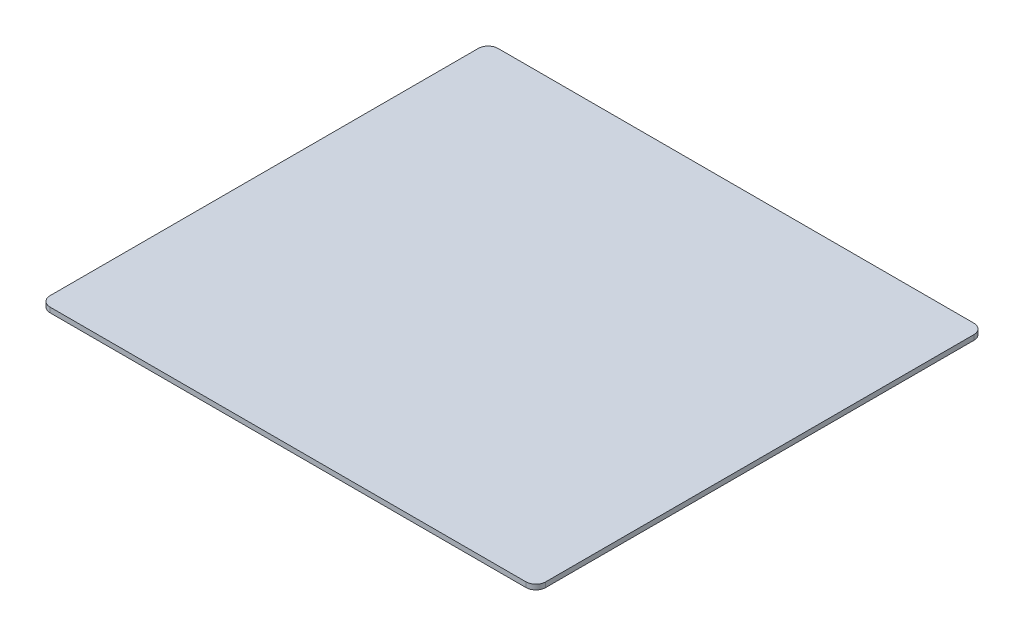
from build123d import *

# Parameters (mm, degrees)
SKETCH1_W           = 158.75
SKETCH1_H           = 143.486267915
BOSS_EXTRUDE1_DEPTH = 1.6002
FILLET1_R           = 3.175


with BuildPart() as part:
    # Sketch1 → Boss-Extrude1 (new body)
    with BuildSketch(Plane(origin=(0, 0, 0), x_dir=(1, 0, 0), z_dir=(0, 1, 0))):
        with Locations((79.375, 71.743133958)):
            Rectangle(SKETCH1_W, SKETCH1_H)
    extrude(amount=BOSS_EXTRUDE1_DEPTH)

    # Fillet1
    fillet1_edges = [part.edges().sort_by_distance(p)[0] for p in [
        (158.75, 0.8001, 0),
        (0, 0.8001, 0),
        (0, 0.8001, -143.486267915),
        (158.75, 0.8001, -143.486267915),
    ]]
    fillet(fillet1_edges, radius=FILLET1_R)


solid = part.part
